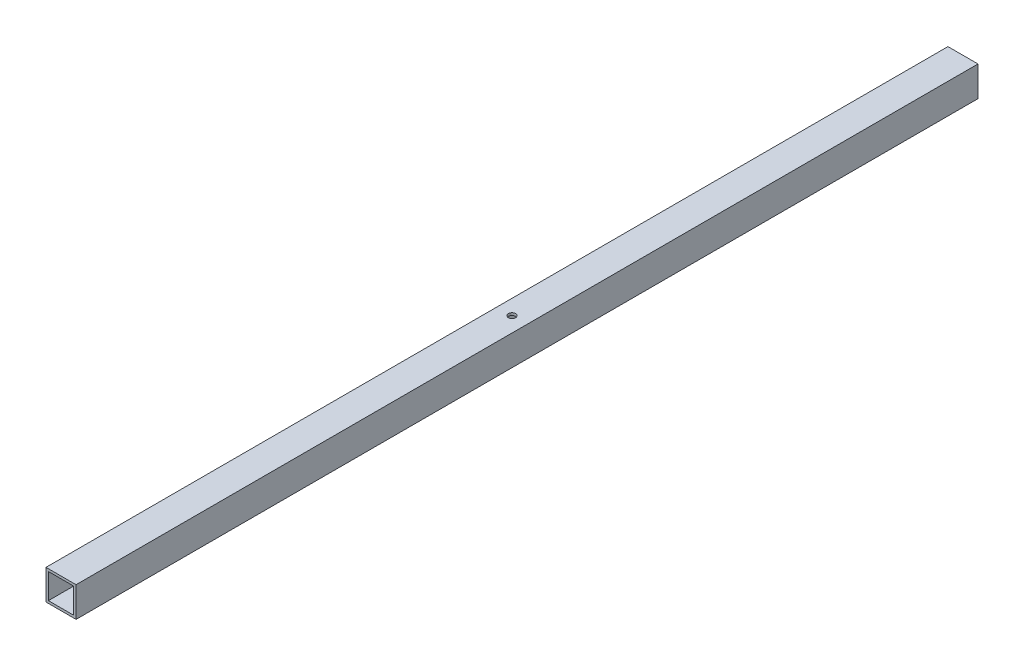
from build123d import *

# Parameters (mm, degrees)
SKETCH_1_W          = 50
SKETCH_1_H          = 50
SKETCH_1_W_2        = 42
SKETCH_1_H_2        = 42
EXTRUDE_1_DEPTH     = 750
SKETCH_2_R          = 6
CUT_EXTRUDE_1_DEPTH = 753.080447825


with BuildPart() as part:
    # 草图1 → 凸台-拉伸1 (new, symmetric)
    with BuildSketch(Plane.XY):
        Rectangle(SKETCH_1_W, SKETCH_1_H)
        Rectangle(SKETCH_1_W_2, SKETCH_1_H_2, mode=Mode.SUBTRACT)
    extrude(amount=EXTRUDE_1_DEPTH, both=True)

    # 草图2 → 切除-拉伸1 (cut, through all)
    with BuildSketch(Plane(origin=(0, 25, 0), x_dir=(1, 0, 0), z_dir=(0, 1, 0))):
        with Locations(Location((0, 0, 0), (0, 0, 270))):
            Circle(SKETCH_2_R)
    extrude(amount=-CUT_EXTRUDE_1_DEPTH, mode=Mode.SUBTRACT)


solid = part.part
